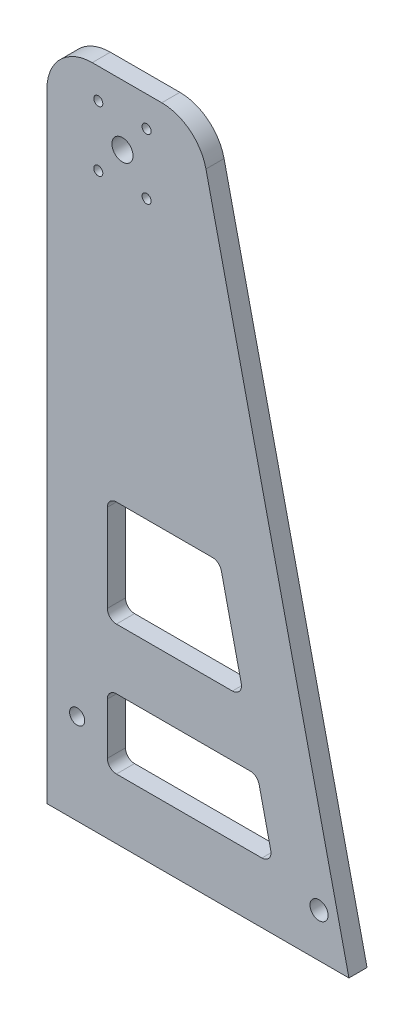
from build123d import *

# Parameters (mm, degrees)
ESBO_O1_R                = 1.5
ESBO_O1_R_2              = 3.5
ESBO_O1_R_3              = 2.5
RESSALTO_EXTRUS_O2_DEPTH = 6
FILETE1_R                = 15
ESBO_O2_R                = 3
CORTE_EXTRUS_O1_DEPTH    = 10


with BuildPart() as part:
    # Esboço1 → Ressalto-extrusão2 (new body)
    with BuildSketch(Plane.XY):
        Polygon((0, 0), (0, 220), (50, 220), (100, 0), align=None)
        with Locations((17, 210)):
            Circle(ESBO_O1_R, mode=Mode.SUBTRACT)
        with Locations(Location((33, 210, 0), (0, 0, 180))):
            Circle(ESBO_O1_R, mode=Mode.SUBTRACT)
        with Locations((33, 190)):
            Circle(ESBO_O1_R, mode=Mode.SUBTRACT)
        with Locations(Location((17, 190, 0), (0, 0, 180))):
            Circle(ESBO_O1_R, mode=Mode.SUBTRACT)
        with Locations((25, 200)):
            Circle(ESBO_O1_R_2, mode=Mode.SUBTRACT)
        with Locations((10, 30)):
            Circle(ESBO_O1_R_3, mode=Mode.SUBTRACT)
        with BuildLine():
            Line((20, 95), (20, 66))
            ThreePointArc((20, 66), (20.878679656, 63.878679656), (23, 63))
            Line((23, 63), (61.413470366, 63))
            ThreePointArc((61.413470366, 63), (63.75810146, 64.128448496), (64.338868934, 66.664863311))
            Line((64.338868934, 66.664863311), (57.747959843, 95.664863311))
            ThreePointArc((57.747959843, 95.664863311), (56.69411278, 97.344631094), (54.822561275, 98))
            Line((54.822561275, 98), (23, 98))
            ThreePointArc((23, 98), (20.878679656, 97.121320344), (20, 95))
        make_face(mode=Mode.SUBTRACT)
        with BuildLine():
            Line((20, 40), (20, 23))
            ThreePointArc((20, 23), (20.878679656, 20.878679656), (23, 20))
            Line((23, 20), (71.186197639, 20))
            ThreePointArc((71.186197639, 20), (73.530828733, 21.128448496), (74.111596206, 23.664863311))
            Line((74.111596206, 23.664863311), (70.247959843, 40.664863311))
            ThreePointArc((70.247959843, 40.664863311), (69.19411278, 42.344631094), (67.322561275, 43))
            Line((67.322561275, 43), (23, 43))
            ThreePointArc((23, 43), (20.878679656, 42.121320344), (20, 40))
        make_face(mode=Mode.SUBTRACT)
    extrude(amount=RESSALTO_EXTRUS_O2_DEPTH)

    # Filete1
    filete1_edges = [part.edges().sort_by_distance(p)[0] for p in [
        (0, 220, 3),
        (50, 220, 3),
    ]]
    fillet(filete1_edges, radius=FILETE1_R)

    # Esboço2 → Corte-extrusão1 (cut)
    with BuildSketch(Plane(origin=(0, 0, 0), x_dir=(-1, 0, 0), z_dir=(0, 0, -1))):
        with Locations((-90.096252795, 14.5)):
            Circle(ESBO_O2_R)
    extrude(amount=-CORTE_EXTRUS_O1_DEPTH, mode=Mode.SUBTRACT)


solid = part.part
